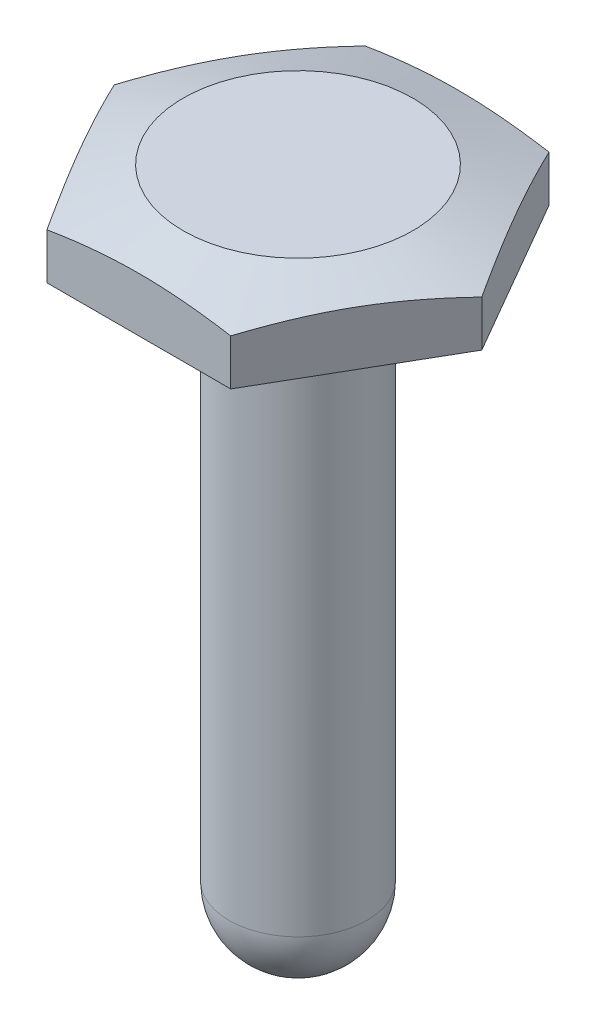
from build123d import *

# Parameters (mm, degrees)
SKETCH2_OUTSIDE_W = 76.662
SKETCH2_OUTSIDE_H = 76.662
HEX_CUT_DEPTH     = 102.798244091


with BuildPart() as part:
    # Sketch1 → Pin Base (revolve)
    with BuildSketch(Plane.XY, mode=Mode.PRIVATE) as pin_base_sk:
        with BuildLine():
            Line((0, 0), (0, -95.25))
            ThreePointArc((0, -95.25), (6.735192091, -92.460192091), (9.525, -85.725))
            Line((9.525, -85.725), (9.525, -9.525))
            Line((9.525, -9.525), (25.4, -9.525))
            Line((25.4, -9.525), (25.4, -3.175))
            Line((25.4, -3.175), (15.875, 0))
            Line((15.875, 0), (0, 0))
        make_face()
    revolve(pin_base_sk.sketch.rotate(Axis((0, 0, 0), (0, -1, 0)), 90), axis=Axis((0, 0, 0), (0, -1, 0)))

    # Sketch2 outside → Hex Cut (cut, through all)
    with BuildSketch(Plane(origin=(0, 0, 0), x_dir=(1, 0, 0), z_dir=(0, 1, 0))):
        Rectangle(SKETCH2_OUTSIDE_W, SKETCH2_OUTSIDE_H)
        Polygon((25.4, 0), (12.7, 21.997045256), (-12.7, 21.997045256), (-25.4, 0), (-12.7, -21.997045256), (12.7, -21.997045256), align=None, mode=Mode.SUBTRACT)
    extrude(amount=-HEX_CUT_DEPTH, mode=Mode.SUBTRACT)


solid = part.part
